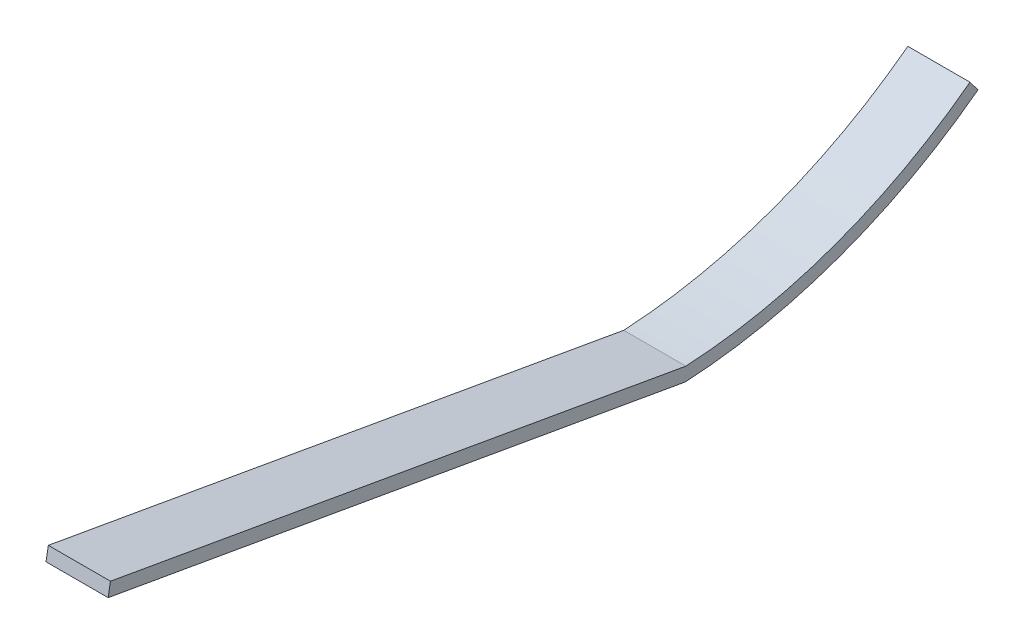
from build123d import *

# Parameters (mm, degrees)
EXTRUDE_THIN1_DEPTH = 70


with BuildPart() as part:
    # Sketch1 → Extrude-Thin1 (new, symmetric)
    with BuildSketch(Plane(origin=(0, 0, 0), x_dir=(0, 0, -1), z_dir=(1, 0, 0))):
        with BuildLine():
            ThreePointArc((660, 240.220354616), (347.968383065, 70.742450573), (0, 0))
            Line((0, 0), (-1300, 229.225074921))
            Line((-1300, 229.225074921), (-1294.79055467, 258.769307511))
            Line((-1294.79055467, 258.769307511), (1.826085437, 30.140810225))
            ThreePointArc((1.826085437, 30.140810225), (339.301235488, 99.514508401), (641.938605277, 264.174185638))
            Line((641.938605277, 264.174185638), (660, 240.220354616))
        make_face()
    extrude(amount=EXTRUDE_THIN1_DEPTH, both=True)


solid = part.part
